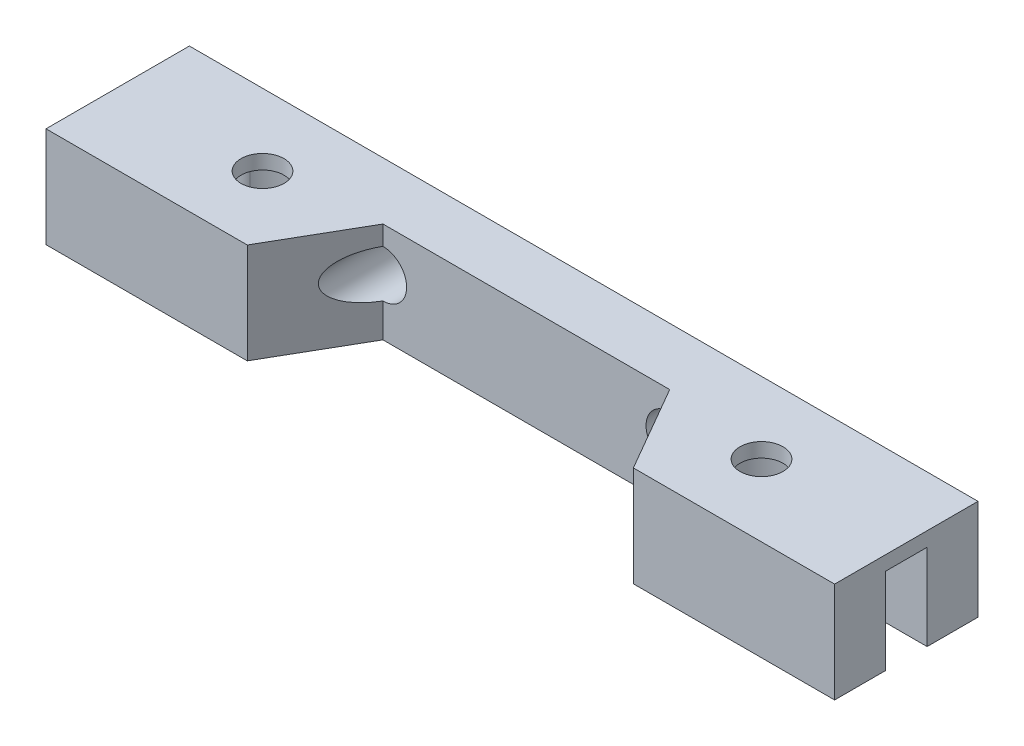
from build123d import *

# Parameters (mm, degrees)
BOSS_EXTRUDE3_DEPTH      = 3
BOSS_EXTRUDE3_DEPTH_BACK = 3
FILLET1_R                = 0.75
SKETCH5_W                = 55
SKETCH5_H                = 10
BOSS_EXTRUDE4_DEPTH      = 1
SKETCH6_R                = 1.65
CUT_EXTRUDE2_DEPTH       = 10
SKETCH7_R                = 1.5
CUT_EXTRUDE3_DEPTH       = 1
CUT_EXTRUDE4_REACH       = 32.087


with BuildPart() as part:
    # Sketch1 → Boss-Extrude3 (new, two sides: drawn at the far end of the back side and taken through both)
    with BuildSketch(Plane(origin=(0, 0, 0), x_dir=(1, 0, 0), z_dir=(0, 1, 0)).offset(-BOSS_EXTRUDE3_DEPTH_BACK)):
        with BuildLine():
            Line((27.5, 10), (-27.5, 10))
            Line((-27.5, 10), (-27.5, 6.45))
            Line((-27.5, 6.45), (-20.252630365, 6.45))
            ThreePointArc((-20.252630365, 6.45), (-14.2, 5), (-20.252630365, 3.55))
            Line((-20.252630365, 3.55), (-27.5, 3.55))
            Line((-27.5, 3.55), (-27.5, 0))
            Line((-27.5, 0), (27.5, 0))
            Line((27.5, 0), (27.5, 3.55))
            Line((27.5, 3.55), (20.252630365, 3.55))
            ThreePointArc((20.252630365, 3.55), (14.2, 5), (20.252630365, 6.45))
            Line((20.252630365, 6.45), (27.5, 6.45))
            Line((27.5, 6.45), (27.5, 10))
        make_face()
    extrude(amount=BOSS_EXTRUDE3_DEPTH + BOSS_EXTRUDE3_DEPTH_BACK)

    # Fillet1
    fillet1_edges = [part.edges().sort_by_distance(p)[0] for p in [
        (-20.252630365, 0, -6.45),
        (20.252630365, 0, -6.45),
        (20.252630365, 0, -3.55),
        (-20.252630365, 0, -3.55),
    ]]
    fillet(fillet1_edges, radius=FILLET1_R)

    # Sketch5 → Boss-Extrude4 (add)
    with BuildSketch(Plane(origin=(0, 3, 0), x_dir=(1, 0, 0), z_dir=(0, 1, 0))):
        with Locations((0, 5)):
            Rectangle(SKETCH5_W, SKETCH5_H)
    extrude(amount=BOSS_EXTRUDE4_DEPTH)

    # Sketch6 → Cut-Extrude2 (cut)
    with BuildSketch(Plane(origin=(0, 0, -10), x_dir=(-1, 0, 0), z_dir=(0, 0, -1))):
        with Locations((-10, 1)):
            Circle(SKETCH6_R)
        with Locations(Location((10, 1, 0), (0, 0, 180))):
            Circle(SKETCH6_R)
    extrude(amount=-CUT_EXTRUDE2_DEPTH, mode=Mode.SUBTRACT)

    # Sketch7 → Cut-Extrude3 (cut)
    with BuildSketch(Plane.XZ.offset(-3)):
        with Locations(Location((-17.4, -5, 0), (0, 0, 270))):
            Circle(SKETCH7_R)
        with Locations(Location((17.4, -5, 0), (0, 0, 270))):
            Circle(SKETCH7_R)
    extrude(amount=-CUT_EXTRUDE3_DEPTH, mode=Mode.SUBTRACT)

    # Cut-Extrude4: up to this face of the body (flat: up to its plane)
    cut_extrude4_end = Plane(part.part.faces().sort_by_distance((0, 4, -5))[0])
    # Sketch8 → Cut-Extrude4 (cut, up to the picked face)
    with BuildSketch(Plane.XZ.offset(3), mode=Mode.PRIVATE) as cut_extrude4_sk1:
        Polygon((-13.464101615, 0), (-10, -6), (10, -6), (13.464101615, 0), align=None)
    cut_extrude4_tool1 = split(extrude(cut_extrude4_sk1.sketch, amount=-CUT_EXTRUDE4_REACH, mode=Mode.PRIVATE), bisect_by=cut_extrude4_end, keep=Keep.BOTH, mode=Mode.PRIVATE)
    add(cut_extrude4_tool1.solids().sort_by(Axis((0, -3, -2.852366), (0, 1, 0)))[0], mode=Mode.SUBTRACT)


solid = part.part
